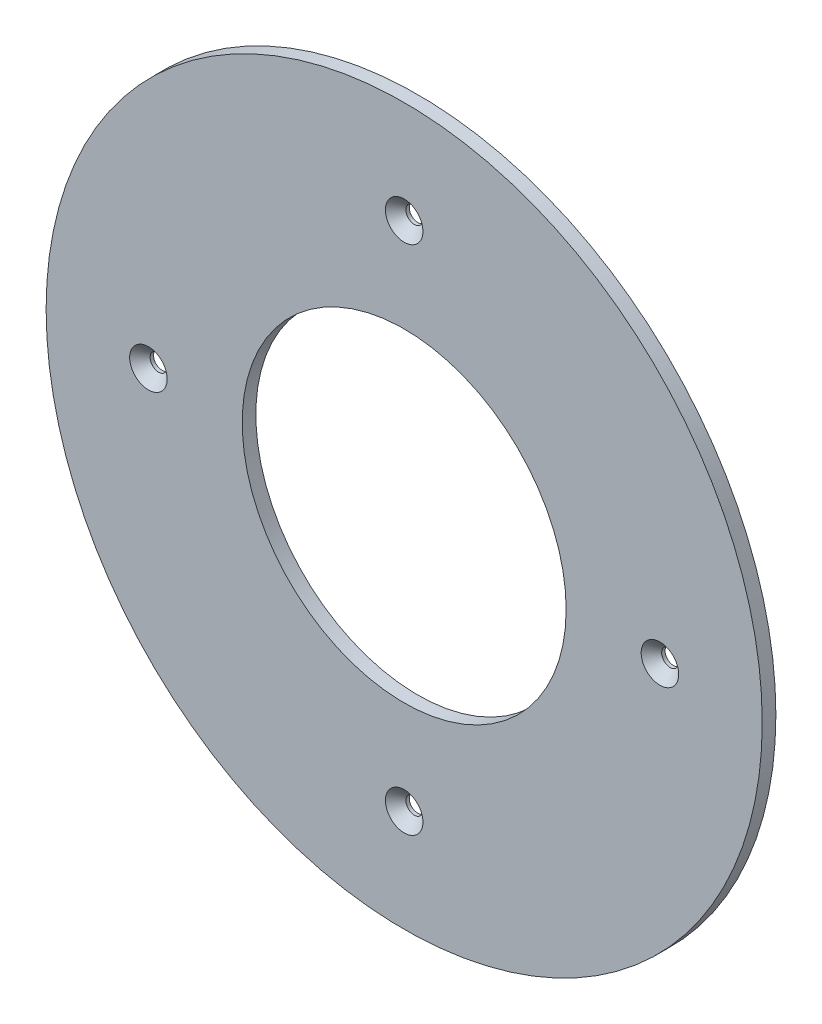
from build123d import *

# Parameters (mm, degrees)
SKETCH1_R           = 105
SKETCH1_R_2         = 47.5
SKETCH1_R_3         = 2.5
BOSS_EXTRUDE1_DEPTH = 4
CHAMFER1_SIZE       = 3


with BuildPart() as part:
    # Sketch1 → Boss-Extrude1 (new body)
    with BuildSketch(Plane.XY):
        Circle(SKETCH1_R)
        Circle(SKETCH1_R_2, mode=Mode.SUBTRACT)
        with Locations((0, 75)):
            Circle(SKETCH1_R_3, mode=Mode.SUBTRACT)
        with Locations((75, 0)):
            Circle(SKETCH1_R_3, mode=Mode.SUBTRACT)
        with Locations((0, -75)):
            Circle(SKETCH1_R_3, mode=Mode.SUBTRACT)
        with Locations((-75, 0)):
            Circle(SKETCH1_R_3, mode=Mode.SUBTRACT)
    extrude(amount=BOSS_EXTRUDE1_DEPTH)

    # Chamfer1
    chamfer1_edges = [part.edges().sort_by_distance(p)[0] for p in [
        (72.5, 0, 4),
        (-2.5, -75, 4),
        (-77.5, 0, 4),
        (-2.5, 75, 4),
    ]]
    chamfer(chamfer1_edges, length=CHAMFER1_SIZE)


solid = part.part
